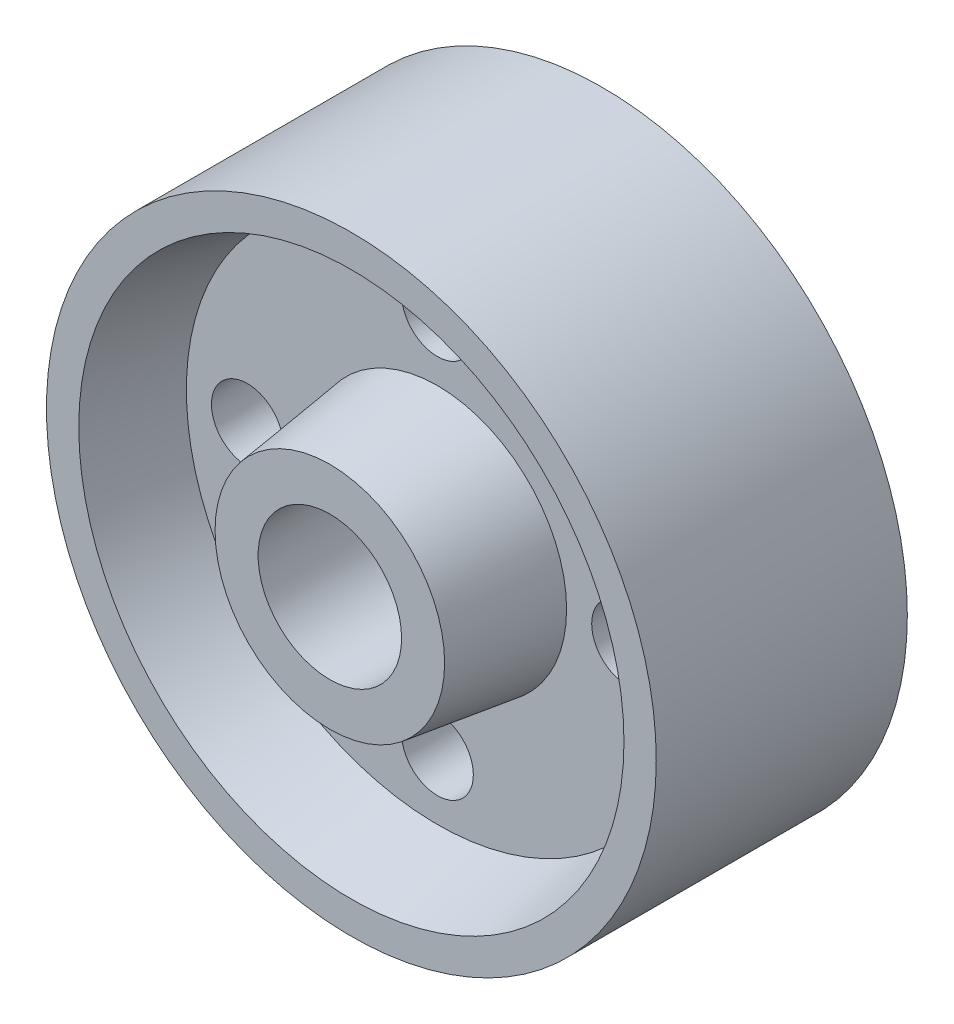
from build123d import *

# Parameters (mm, degrees)
SKETCH3_R          = 10
SKETCH3_R_2        = 5
CUT_EXTRUDE1_DEPTH = 73.756443014


with BuildPart() as part:
    # Sketch2 → Revolve1 (revolve)
    with BuildSketch(Plane(origin=(0, 0, 0), x_dir=(0, 0, -1), z_dir=(1, 0, 0)), mode=Mode.PRIVATE) as revolve1_sk:
        Polygon((-17.5, 42.5), (17.5, 42.5), (17.5, 38), (5.5, 35), (5.5, 18), (20.5, 16), (20.5, 0), (-20.5, 0), (-20.5, 16), (-5.5, 18), (-5.5, 35), (-17.5, 38), align=None)
    revolve(revolve1_sk.sketch.rotate(Axis((0, 0, 152.018729057), (0, 0, -1)), 90), axis=Axis((0, 0, 152.018729057), (0, 0, -1)))

    # Sketch3 → Cut-Extrude1 (cut, through all)
    with BuildSketch(Plane.XY.offset(20.5)):
        Circle(SKETCH3_R)
        with Locations((0, 26.5)):
            Circle(SKETCH3_R_2)
        with Locations((26.5, 0)):
            Circle(SKETCH3_R_2)
        with Locations((0, -26.5)):
            Circle(SKETCH3_R_2)
        with Locations((-26.5, 0)):
            Circle(SKETCH3_R_2)
    extrude(amount=-CUT_EXTRUDE1_DEPTH, mode=Mode.SUBTRACT)


solid = part.part
